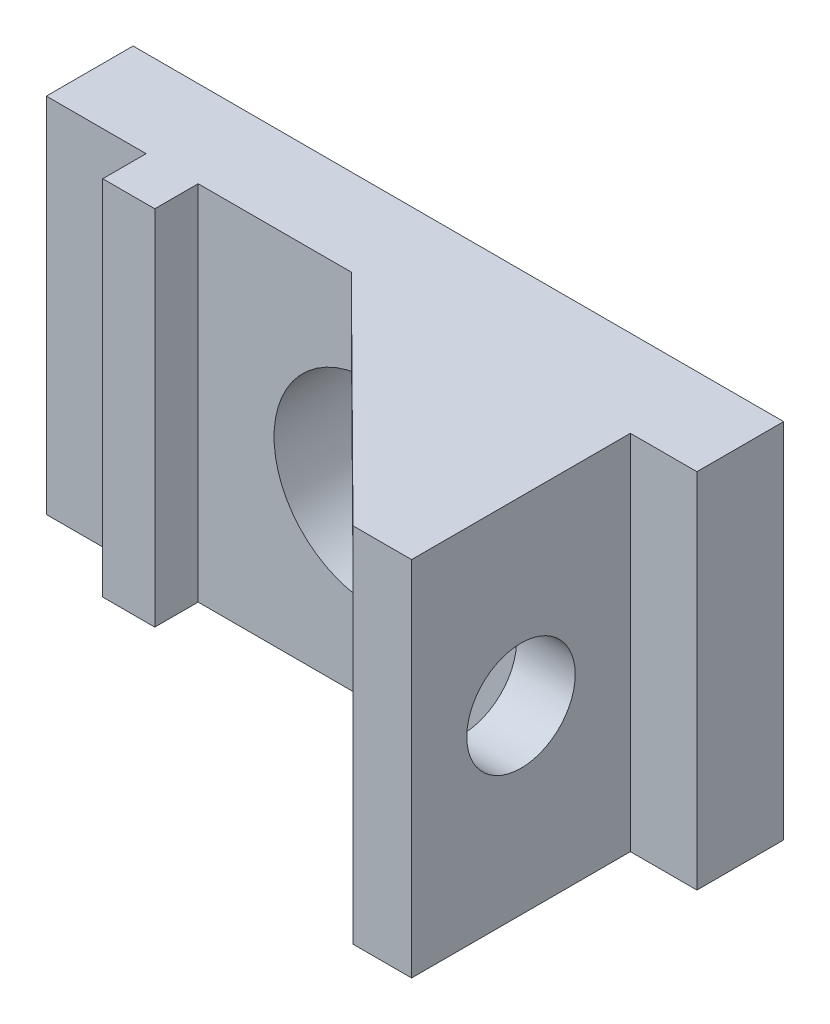
from build123d import *

# Parameters (mm, degrees)
SKETCH_2_W          = 23
SKETCH_2_H          = 83.54692924
EXTRUDE_1_DEPTH     = 20
SKETCH_2_W_2        = 115
SKETCH_2_R          = 22.5
EXTRUDE_1_2_DEPTH   = 20
SKETCH_2_3_W        = 12
SKETCH_2_3_H        = 83.54692924
EXTRUDE_2_DEPTH     = 30
SKETCH_4_W          = 13.50460444
SKETCH_4_H          = 50.449539632
EXTRUDE_4_DEPTH     = 83.54692924
SKETCH_6_R          = 12.5
CUT_EXTRUDE_1_DEPTH = 164.164371188
EXTRUDE_5_DEPTH     = 10


with BuildPart() as part:
    # Эскиз2 → Бобышка-Вытянуть1 (new body)
    with BuildSketch(Plane.XY):
        with Locations((11.5, -41.77346462)):
            Rectangle(SKETCH_2_W, SKETCH_2_H)
    extrude(amount=EXTRUDE_1_DEPTH)



with BuildPart() as body_2:
    # Эскиз2 → Extrude 1 2 (new body)
    with BuildSketch(Plane.XY):
        with Locations((92.5, -41.77346462)):
            Rectangle(SKETCH_2_W_2, SKETCH_2_H)
        with Locations((75, -41.77346462)):
            Circle(SKETCH_2_R, mode=Mode.SUBTRACT)
    extrude(amount=EXTRUDE_1_2_DEPTH)


with BuildPart() as part_1:
    add(part.part)

    add(body_2.part)  # Бобышка-Вытянуть2 merges body 2
    # Эскиз2<3> → Бобышка-Вытянуть2 (add)
    with BuildSketch(Plane.XY):
        with Locations((29, -41.77346462)):
            Rectangle(SKETCH_2_3_W, SKETCH_2_3_H)
    extrude(amount=EXTRUDE_2_DEPTH)

    # Эскиз4 → Бобышка-Вытянуть4 (add)
    with BuildSketch(Plane(origin=(0, 0, 0), x_dir=(1, 0, 0), z_dir=(0, 1, 0))):
        with Locations((127.910814118, -45.224769816)):
            Rectangle(SKETCH_4_W, SKETCH_4_H)
    extrude(amount=-EXTRUDE_4_DEPTH)

    # Эскиз6 → Вырез-Вытянуть1 (cut, through all)
    with BuildSketch(Plane.ZY.offset(-121.158511898)):
        with Locations((45.224769816, -41.77346462)):
            Circle(SKETCH_6_R)
    extrude(amount=-CUT_EXTRUDE_1_DEPTH, mode=Mode.SUBTRACT)

    # Эскиз7 → Бобышка-Вытянуть5 (add)
    with BuildSketch(Plane(origin=(0, 0, 0), x_dir=(1, 0, 0), z_dir=(0, 1, 0))):
        Polygon((121.158511898, -70.449539632), (70.320934242, -20), (121.158511898, -20), align=None)
    extrude(amount=-EXTRUDE_5_DEPTH)


solid = part_1.part
